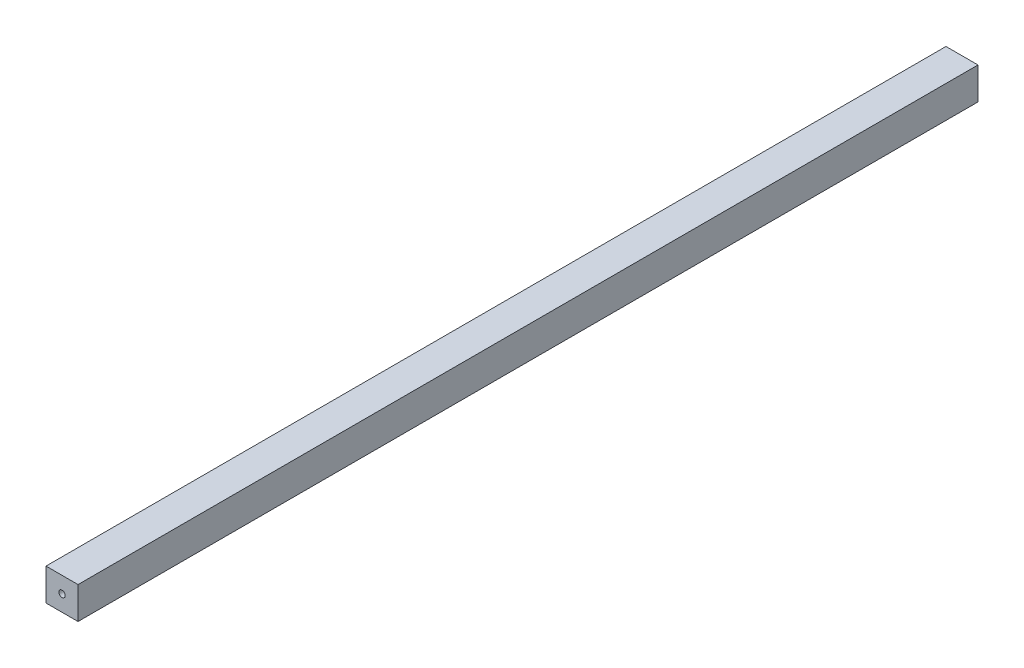
from build123d import *

# Parameters (mm, degrees)
SKETCH1_W                 = 20
SKETCH1_H                 = 20
BOSS_EXTRUDE1_DEPTH       = 562
F_3_0MM_DOWEL_HOLE1_D     = 3
F_3_0MM_DOWEL_HOLE1_DEPTH = 8
F_3_0MM_DOWEL_HOLE1_TIP   = 0.901290929
F_4_0MM_DOWEL_HOLE1_D     = 4
F_4_0MM_DOWEL_HOLE1_DEPTH = 6
F_4_0MM_DOWEL_HOLE1_TIP   = 1.201721238
F_4_0MM_DOWEL_HOLE2_D     = 4
F_4_0MM_DOWEL_HOLE2_DEPTH = 6
F_4_0MM_DOWEL_HOLE2_TIP   = 1.201721238


with BuildPart() as part:
    # Sketch1 → Boss-Extrude1 (new body)
    with BuildSketch(Plane.XY):
        with Locations((10, 10)):
            Rectangle(SKETCH1_W, SKETCH1_H)
    extrude(amount=BOSS_EXTRUDE1_DEPTH)

    # Ø3.0mm Dowel Hole1
    with Locations(Plane.ZY):
        with Locations((551, 10), (491, 10), (431, 10), (371, 10), (311, 10), (251, 10), (191, 10), (131, 10), (71, 10), (11, 10)):
            Hole(F_3_0MM_DOWEL_HOLE1_D / 2, depth=F_3_0MM_DOWEL_HOLE1_DEPTH)
            with Locations((0, 0, -(F_3_0MM_DOWEL_HOLE1_DEPTH + F_3_0MM_DOWEL_HOLE1_TIP / 2))):  # 118° drill point
                Cone(0, F_3_0MM_DOWEL_HOLE1_D / 2, F_3_0MM_DOWEL_HOLE1_TIP, mode=Mode.SUBTRACT)

    # Ø4.0mm Dowel Hole1
    with Locations(Plane.XY.offset(562)):
        with Locations((10, 10)):
            Hole(F_4_0MM_DOWEL_HOLE1_D / 2, depth=F_4_0MM_DOWEL_HOLE1_DEPTH)
            with Locations((0, 0, -(F_4_0MM_DOWEL_HOLE1_DEPTH + F_4_0MM_DOWEL_HOLE1_TIP / 2))):  # 118° drill point
                Cone(0, F_4_0MM_DOWEL_HOLE1_D / 2, F_4_0MM_DOWEL_HOLE1_TIP, mode=Mode.SUBTRACT)

    # Ø4.0mm Dowel Hole2
    with Locations(Plane(origin=(0, 0, 0), x_dir=(-1, 0, 0), z_dir=(0, 0, -1))):
        with Locations((-10, 10)):
            Hole(F_4_0MM_DOWEL_HOLE2_D / 2, depth=F_4_0MM_DOWEL_HOLE2_DEPTH)
            with Locations((0, 0, -(F_4_0MM_DOWEL_HOLE2_DEPTH + F_4_0MM_DOWEL_HOLE2_TIP / 2))):  # 118° drill point
                Cone(0, F_4_0MM_DOWEL_HOLE2_D / 2, F_4_0MM_DOWEL_HOLE2_TIP, mode=Mode.SUBTRACT)


solid = part.part
